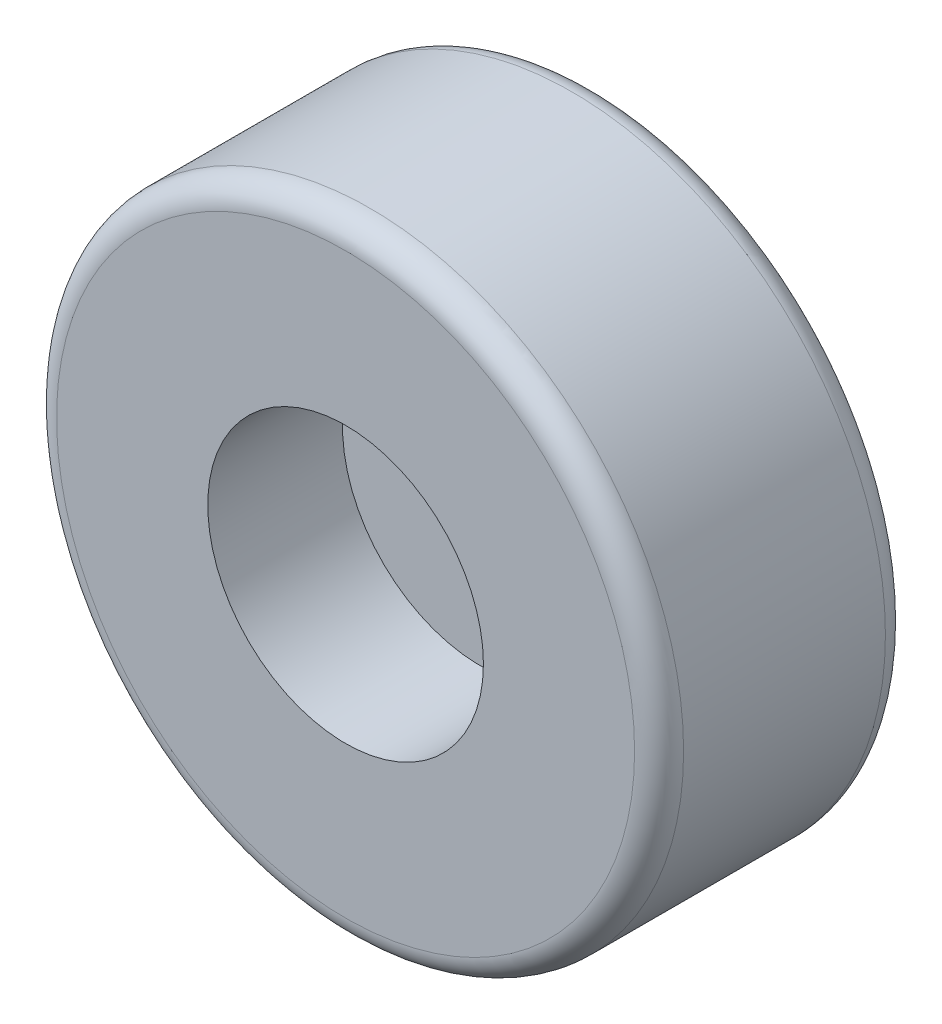
from build123d import *

# Parameters (mm, degrees)
SKETCH1_R           = 32.5
BOSS_EXTRUDE1_DEPTH = 26
FILLET1_R           = 2.54
SKETCH2_R           = 3.1115
CUT_EXTRUDE1_DEPTH  = 26
SKETCH3_R           = 14.2875
CUT_EXTRUDE2_DEPTH  = 13.97


with BuildPart() as part:
    # Sketch1 → Boss-Extrude1 (new body)
    with BuildSketch(Plane.XY):
        with Locations(Location((0, 0, 0), (0, 0, 180))):
            Circle(SKETCH1_R)
    extrude(amount=BOSS_EXTRUDE1_DEPTH)

    # Fillet1
    fillet1_edges = [part.edges().sort_by_distance(p)[0] for p in [
        (32.5, 0, 0),
        (32.5, 0, 26),
    ]]
    fillet(fillet1_edges, radius=FILLET1_R)

    # Sketch2 → Cut-Extrude1 (cut)
    with BuildSketch(Plane.XY.offset(26)):
        Circle(SKETCH2_R)
    extrude(amount=-CUT_EXTRUDE1_DEPTH, mode=Mode.SUBTRACT)

    # Sketch3 → Cut-Extrude2 (cut)
    with BuildSketch(Plane.XY.offset(26)):
        Circle(SKETCH3_R)
    extrude(amount=-CUT_EXTRUDE2_DEPTH, mode=Mode.SUBTRACT)


solid = part.part
